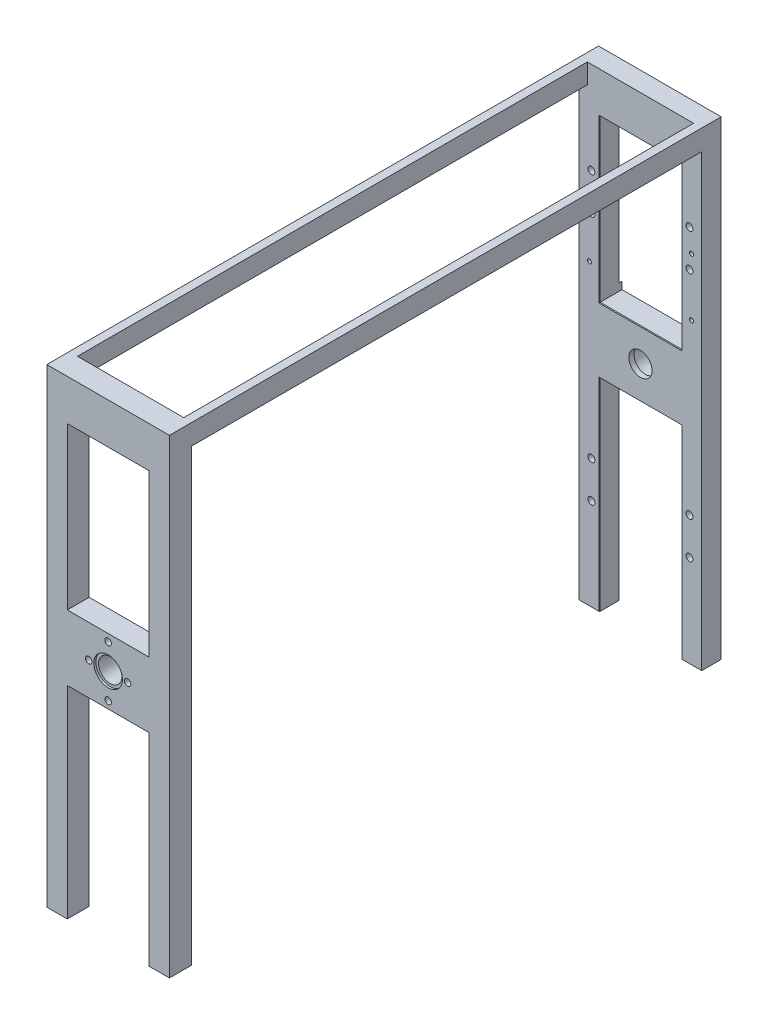
from build123d import *

# Parameters (mm, degrees)
BOSS_EXTRUDE1_START                            = -8
SKETCH1_W                                      = 60
SKETCH1_H                                      = 230
BOSS_EXTRUDE1_DEPTH                            = 11
CUT_EXTRUDE1_DEPTH                             = 120.117588961
CUT_EXTRUDE1_DEPTH_BACK                        = 120.117588961
SKETCH2_W                                      = 40
SKETCH2_H                                      = 99
CUT_EXTRUDE2_DEPTH                             = 120.117588961
CUT_EXTRUDE2_DEPTH_BACK                        = 120.117588961
SKETCH3_W                                      = 40
SKETCH3_H                                      = 79
SKETCH4_W                                      = 60
SKETCH4_H                                      = 230
BOSS_EXTRUDE3_DEPTH                            = 11
CUT_EXTRUDE3_DEPTH                             = 297.373497466
CUT_EXTRUDE3_DEPTH_BACK                        = 297.373497466
SKETCH6_W                                      = 40
SKETCH6_H                                      = 79
CUT_EXTRUDE4_DEPTH                             = 287.33066549
CUT_EXTRUDE4_DEPTH_BACK                        = 287.33066549
SKETCH7_W                                      = 40
SKETCH7_H                                      = 99
SKETCH8_W                                      = 4
SKETCH8_H                                      = 10
BOSS_EXTRUDE4_DEPTH                            = 249.5
CUT_EXTRUDE13_DEPTH                            = 287.33066549
CUT_EXTRUDE13_DEPTH_BACK                       = 287.33066549
SKETCH9_R                                      = 6.5
CUT_EXTRUDE15_START                            = -10
SKETCH13_R                                     = 7
CUT_EXTRUDE15_DEPTH                            = 1
SKETCH14_R                                     = 7
CUT_EXTRUDE16_DEPTH                            = 1
CUT_EXTRUDE17_REACH                            = 298.373
SKETCH15_R                                     = 1.6
SKETCH17_W                                     = 10
SKETCH17_H                                     = 34
BOSS_EXTRUDE5_DEPTH                            = 6
CUT_EXTRUDE18_REACH                            = 303.88
SKETCH18_R                                     = 1
CHAMFER1_SIZE                                  = 0.3
CHAMFER2_SIZE                                  = 0.3
CHAMFER3_SIZE                                  = 0.3
CHAMFER4_SIZE                                  = 0.3
CHAMFER5_SIZE                                  = 0.3
UPPER_BEARING_HOUSING_EXTENSION_START          = 248.7
SKETCH19_R                                     = 10
SKETCH19_R_2                                   = 6.5
UPPER_BEARING_HOUSING_EXTENSION_DEPTH          = 3.9
LOWER_BEARING_OUTER_RACE_SHOULDER_START        = 0.5
SKETCH20_R                                     = 6.51
SKETCH20_R_2                                   = 5.7
LOWER_BEARING_OUTER_RACE_SHOULDER_DEPTH        = 2.5
UPPER_BEARING_OUTER_RACE_SHOULDER_START        = 253.7
SKETCH21_R                                     = 6.51
SKETCH21_R_2                                   = 5.7
UPPER_BEARING_OUTER_RACE_SHOULDER_DEPTH        = 8.8
SKETCH22_R                                     = 1.7
FOUR_STAGE_SUPPORT_D3P4_DEPTH                  = 17.01
SKETCH23_R                                     = 1
LOWER_RETAINER_M2_ENVELOPE_DEPTH               = 3.2
SKETCH24_R                                     = 1
UPPER_RETAINER_M2_ENVELOPE_DEPTH               = 3.2
SKETCH25_R                                     = 130
SKETCH25_R_2                                   = 28
PITCH_LINKAGE_UNDERSIDE_CLEARANCE_R28_UP_DEPTH = 7.5
SKETCH26_R                                     = 1.7
FOUR_LINK_FRAME_SUPPORT_HOLES_Y70_DEPTH        = 9.51


with BuildPart() as part:
    # Sketch1 → Boss-Extrude1 (new body)
    with BuildSketch(Plane.XY.offset(BOSS_EXTRUDE1_START)):
        Rectangle(SKETCH1_W, SKETCH1_H)
    extrude(amount=BOSS_EXTRUDE1_DEPTH)

    # Sketch2 → Cut-Extrude1 (cut, two sides: drawn at the far end of the back side and taken through both)
    with BuildSketch(Plane.XY.offset(-CUT_EXTRUDE1_DEPTH_BACK)):
        with Locations((0, -65.5)):
            Rectangle(SKETCH2_W, SKETCH2_H)
    extrude(amount=CUT_EXTRUDE1_DEPTH + CUT_EXTRUDE1_DEPTH_BACK, mode=Mode.SUBTRACT)

    # Sketch3 → Cut-Extrude2 (cut, two sides: drawn at the far end of the back side and taken through both)
    with BuildSketch(Plane.XY.offset(-CUT_EXTRUDE2_DEPTH_BACK)):
        with Locations((0, 55.5)):
            Rectangle(SKETCH3_W, SKETCH3_H)
    extrude(amount=CUT_EXTRUDE2_DEPTH + CUT_EXTRUDE2_DEPTH_BACK, mode=Mode.SUBTRACT)



with BuildPart() as body_2:
    # Sketch4 → Boss-Extrude3 (new body)
    with BuildSketch(Plane.XY.offset(252.5)):
        Rectangle(SKETCH4_W, SKETCH4_H)
    extrude(amount=BOSS_EXTRUDE3_DEPTH)

    # Sketch6 → Cut-Extrude3 (cut, two sides: drawn at the far end of the back side and taken through both)
    with BuildSketch(Plane.XY.offset(263.5).offset(-CUT_EXTRUDE3_DEPTH_BACK)):
        with Locations((0, 55.5)):
            Rectangle(SKETCH6_W, SKETCH6_H)
    extrude(amount=CUT_EXTRUDE3_DEPTH + CUT_EXTRUDE3_DEPTH_BACK, mode=Mode.SUBTRACT)

    # Sketch7 → Cut-Extrude4 (cut, two sides: drawn at the far end of the back side and taken through both)
    with BuildSketch(Plane.XY.offset(252.5).offset(-CUT_EXTRUDE4_DEPTH_BACK)):
        with Locations((0, -65.5)):
            Rectangle(SKETCH7_W, SKETCH7_H)
    extrude(amount=CUT_EXTRUDE4_DEPTH + CUT_EXTRUDE4_DEPTH_BACK, mode=Mode.SUBTRACT)


with BuildPart() as part_1:
    add(part.part)

    add(body_2.part)  # Boss-Extrude4 merges body 2
    # Sketch8 → Boss-Extrude4 (add)
    with BuildSketch(Plane.XY.offset(3)):
        with Locations((-28, 110)):
            Rectangle(SKETCH8_W, SKETCH8_H)
        with Locations((28, 110)):
            Rectangle(SKETCH8_W, SKETCH8_H)
    extrude(amount=BOSS_EXTRUDE4_DEPTH)

    # Sketch9 → Cut-Extrude13 (cut, two sides: drawn at the far end of the back side and taken through both)
    with BuildSketch(Plane.XY.offset(252.5).offset(-CUT_EXTRUDE13_DEPTH_BACK)):
        with Locations(Location((0, 0, 0), (0, 0, 180))):
            Circle(SKETCH9_R)
    extrude(amount=CUT_EXTRUDE13_DEPTH + CUT_EXTRUDE13_DEPTH_BACK, mode=Mode.SUBTRACT)

    # Sketch13 → Cut-Extrude15 (cut)
    with BuildSketch(Plane(origin=(0, 0, 252.5), x_dir=(-1, 0, 0), z_dir=(0, 0, -1)).offset(CUT_EXTRUDE15_START)):
        Circle(SKETCH13_R)
    extrude(amount=-CUT_EXTRUDE15_DEPTH, mode=Mode.SUBTRACT)

    # Sketch14 → Cut-Extrude16 (cut)
    with BuildSketch(Plane(origin=(0, 0, -8), x_dir=(-1, 0, 0), z_dir=(0, 0, -1))):
        Circle(SKETCH14_R)
    extrude(amount=-CUT_EXTRUDE16_DEPTH, mode=Mode.SUBTRACT)

    # Sketch15 → Cut-Extrude17 (cut, up to next)
    with BuildSketch(Plane.XY.offset(263.5), mode=Mode.PRIVATE) as cut_extrude17_sk1:
        with Locations((9.5, 0)):
            Circle(SKETCH15_R)
    cut_extrude17_tool1 = extrude(cut_extrude17_sk1.sketch, amount=-CUT_EXTRUDE17_REACH, mode=Mode.PRIVATE) & part_1.part
    # Sketch15 → Cut-Extrude17 (cut, up to next)
    with BuildSketch(Plane.XY.offset(263.5), mode=Mode.PRIVATE) as cut_extrude17_sk2:
        with Locations(Location((-9.5, 0, 0), (0, 0, 180))):
            Circle(SKETCH15_R)
    cut_extrude17_tool2 = extrude(cut_extrude17_sk2.sketch, amount=-CUT_EXTRUDE17_REACH, mode=Mode.PRIVATE) & part_1.part
    # Sketch15 → Cut-Extrude17 (cut, up to next)
    with BuildSketch(Plane.XY.offset(263.5), mode=Mode.PRIVATE) as cut_extrude17_sk3:
        with Locations((0, 12.5)):
            Circle(SKETCH15_R)
    cut_extrude17_tool3 = extrude(cut_extrude17_sk3.sketch, amount=-CUT_EXTRUDE17_REACH, mode=Mode.PRIVATE) & part_1.part
    # Sketch15 → Cut-Extrude17 (cut, up to next)
    with BuildSketch(Plane.XY.offset(263.5), mode=Mode.PRIVATE) as cut_extrude17_sk4:
        with Locations(Location((0, -12.5, 0), (0, 0, 180))):
            Circle(SKETCH15_R)
    cut_extrude17_tool4 = extrude(cut_extrude17_sk4.sketch, amount=-CUT_EXTRUDE17_REACH, mode=Mode.PRIVATE) & part_1.part
    add(cut_extrude17_tool1.solids().sort_by_distance((9.5, 0, 263.5))[0], mode=Mode.SUBTRACT)
    add(cut_extrude17_tool2.solids().sort_by_distance((-9.5, 0, 263.5))[0], mode=Mode.SUBTRACT)
    add(cut_extrude17_tool3.solids().sort_by_distance((0, 12.5, 263.5))[0], mode=Mode.SUBTRACT)
    add(cut_extrude17_tool4.solids().sort_by_distance((0, -12.5, 263.5))[0], mode=Mode.SUBTRACT)

    # Sketch17 → Boss-Extrude5 (add)
    with BuildSketch(Plane(origin=(0, 0, -8), x_dir=(-1, 0, 0), z_dir=(0, 0, -1))):
        with Locations((25, 45)):
            Rectangle(SKETCH17_W, SKETCH17_H)
        with Locations((-25, 45)):
            Rectangle(SKETCH17_W, SKETCH17_H)
    extrude(amount=BOSS_EXTRUDE5_DEPTH)

    # Sketch18 → Cut-Extrude18 (cut, up to next)
    with BuildSketch(Plane(origin=(0, 0, -14), x_dir=(-1, 0, 0), z_dir=(0, 0, -1)), mode=Mode.PRIVATE) as cut_extrude18_sk1:
        with Locations((-25, 59.2)):
            Circle(SKETCH18_R)
    cut_extrude18_tool1 = extrude(cut_extrude18_sk1.sketch, amount=-CUT_EXTRUDE18_REACH, mode=Mode.PRIVATE) & part_1.part
    # Sketch18 → Cut-Extrude18 (cut, up to next)
    with BuildSketch(Plane(origin=(0, 0, -14), x_dir=(-1, 0, 0), z_dir=(0, 0, -1)), mode=Mode.PRIVATE) as cut_extrude18_sk2:
        with Locations((-25, 31)):
            Circle(SKETCH18_R)
    cut_extrude18_tool2 = extrude(cut_extrude18_sk2.sketch, amount=-CUT_EXTRUDE18_REACH, mode=Mode.PRIVATE) & part_1.part
    # Sketch18 → Cut-Extrude18 (cut, up to next)
    with BuildSketch(Plane(origin=(0, 0, -14), x_dir=(-1, 0, 0), z_dir=(0, 0, -1)), mode=Mode.PRIVATE) as cut_extrude18_sk3:
        with Locations((25, 59.2)):
            Circle(SKETCH18_R)
    cut_extrude18_tool3 = extrude(cut_extrude18_sk3.sketch, amount=-CUT_EXTRUDE18_REACH, mode=Mode.PRIVATE) & part_1.part
    # Sketch18 → Cut-Extrude18 (cut, up to next)
    with BuildSketch(Plane(origin=(0, 0, -14), x_dir=(-1, 0, 0), z_dir=(0, 0, -1)), mode=Mode.PRIVATE) as cut_extrude18_sk4:
        with Locations((25, 31)):
            Circle(SKETCH18_R)
    cut_extrude18_tool4 = extrude(cut_extrude18_sk4.sketch, amount=-CUT_EXTRUDE18_REACH, mode=Mode.PRIVATE) & part_1.part
    add(cut_extrude18_tool1.solids().sort_by_distance((25, 59.2, -14))[0], mode=Mode.SUBTRACT)
    add(cut_extrude18_tool2.solids().sort_by_distance((25, 31, -14))[0], mode=Mode.SUBTRACT)
    add(cut_extrude18_tool3.solids().sort_by_distance((-25, 59.2, -14))[0], mode=Mode.SUBTRACT)
    add(cut_extrude18_tool4.solids().sort_by_distance((-25, 31, -14))[0], mode=Mode.SUBTRACT)

    # Chamfer1
    chamfer1_edges = [part_1.edges().sort_by_distance(p)[0] for p in [
        (-30, -5, 252.5),
    ]]
    chamfer(chamfer1_edges, length=CHAMFER1_SIZE)

    # Chamfer2
    chamfer2_edges = [part_1.edges().sort_by_distance(p)[0] for p in [
        (30, -5, 252.5),
    ]]
    chamfer(chamfer2_edges, length=CHAMFER2_SIZE)

    # Chamfer3
    chamfer3_edges = [part_1.edges().sort_by_distance(p)[0] for p in [
        (-26, 105, 127.75),
        (26, 105, 127.75),
    ]]
    chamfer(chamfer3_edges, length=CHAMFER3_SIZE)

    # Chamfer4
    chamfer4_edges = [part_1.edges().sort_by_distance(p)[0] for p in [
        (-20, -65.5, 3),
        (20, -65.5, 3),
        (0, -16, 3),
        (20, 55.5, 3),
        (0, 95, 3),
        (-20, 55.5, 3),
        (0, 16, 3),
    ]]
    chamfer(chamfer4_edges, length=CHAMFER4_SIZE)

    # Chamfer5
    chamfer5_edges = [part_1.edges().sort_by_distance(p)[0] for p in [
        (20, -65.5, 252.5),
        (0, -16, 252.5),
        (-20, -65.5, 252.5),
        (20, 55.5, 252.5),
        (0, 16, 252.5),
        (-20, 55.5, 252.5),
        (0, 95, 252.5),
    ]]
    chamfer(chamfer5_edges, length=CHAMFER5_SIZE)

    # Sketch19 → Upper_Bearing_Housing_Extension (add)
    with BuildSketch(Plane.XY.offset(UPPER_BEARING_HOUSING_EXTENSION_START)):
        with Locations(Location((0, 0, 0), (0, 0, 188.943506205))):
            Circle(SKETCH19_R)
        with Locations(Location((0, 0, 0), (0, 0, 180))):
            Circle(SKETCH19_R_2, mode=Mode.SUBTRACT)
    extrude(amount=UPPER_BEARING_HOUSING_EXTENSION_DEPTH)

    # Sketch20 → Lower_Bearing_Outer_Race_Shoulder (add)
    with BuildSketch(Plane.XY.offset(LOWER_BEARING_OUTER_RACE_SHOULDER_START)):
        Circle(SKETCH20_R)
        Circle(SKETCH20_R_2, mode=Mode.SUBTRACT)
    extrude(amount=LOWER_BEARING_OUTER_RACE_SHOULDER_DEPTH)

    # Sketch21 → Upper_Bearing_Outer_Race_Shoulder (add)
    with BuildSketch(Plane.XY.offset(UPPER_BEARING_OUTER_RACE_SHOULDER_START)):
        Circle(SKETCH21_R)
        Circle(SKETCH21_R_2, mode=Mode.SUBTRACT)
    extrude(amount=UPPER_BEARING_OUTER_RACE_SHOULDER_DEPTH)

    # Sketch22 → Four_Stage_Support_D3p4 (cut)
    with BuildSketch(Plane.XY.offset(3)):
        with Locations((-24, -52)):
            Circle(SKETCH22_R)
        with Locations((-24, 52)):
            Circle(SKETCH22_R)
        with Locations((24, -52)):
            Circle(SKETCH22_R)
        with Locations((24, 52)):
            Circle(SKETCH22_R)
    extrude(amount=-FOUR_STAGE_SUPPORT_D3P4_DEPTH, mode=Mode.SUBTRACT)

    # Sketch23 → Lower_Retainer_M2_Envelope (cut)
    with BuildSketch(Plane(origin=(0, 0, -8), x_dir=(-1, 0, 0), z_dir=(0, 0, -1))):
        with Locations((-7.188010851, 4.15)):
            Circle(SKETCH23_R)
        with Locations((7.188010851, 4.15)):
            Circle(SKETCH23_R)
        with Locations((0, -8.3)):
            Circle(SKETCH23_R)
    extrude(amount=-LOWER_RETAINER_M2_ENVELOPE_DEPTH, mode=Mode.SUBTRACT)

    # Sketch24 → Upper_Retainer_M2_Envelope (cut)
    with BuildSketch(Plane(origin=(0, 0, 248.7), x_dir=(-1, 0, 0), z_dir=(0, 0, -1))):
        with Locations((-7.188010851, 4.15)):
            Circle(SKETCH24_R)
        with Locations((7.188010851, 4.15)):
            Circle(SKETCH24_R)
        with Locations((0, -8.3)):
            Circle(SKETCH24_R)
    extrude(amount=-UPPER_RETAINER_M2_ENVELOPE_DEPTH, mode=Mode.SUBTRACT)

    # Sketch25 → Pitch_Linkage_Underside_Clearance_R28_Up7p5 (cut)
    with BuildSketch(Plane(origin=(0, 0, -14), x_dir=(-1, 0, 0), z_dir=(0, 0, -1))):
        Circle(SKETCH25_R)
        Circle(SKETCH25_R_2, mode=Mode.SUBTRACT)
    extrude(amount=-PITCH_LINKAGE_UNDERSIDE_CLEARANCE_R28_UP_DEPTH, mode=Mode.SUBTRACT)

    # Sketch26 → Four_Link_Frame_Support_Holes_Y70 (cut)
    with BuildSketch(Plane.XY.offset(3)):
        with Locations((-24, -70)):
            Circle(SKETCH26_R)
        with Locations((-24, 70)):
            Circle(SKETCH26_R)
        with Locations((24, -70)):
            Circle(SKETCH26_R)
        with Locations((24, 70)):
            Circle(SKETCH26_R)
    extrude(amount=-FOUR_LINK_FRAME_SUPPORT_HOLES_Y70_DEPTH, mode=Mode.SUBTRACT)


solid = part_1.part
